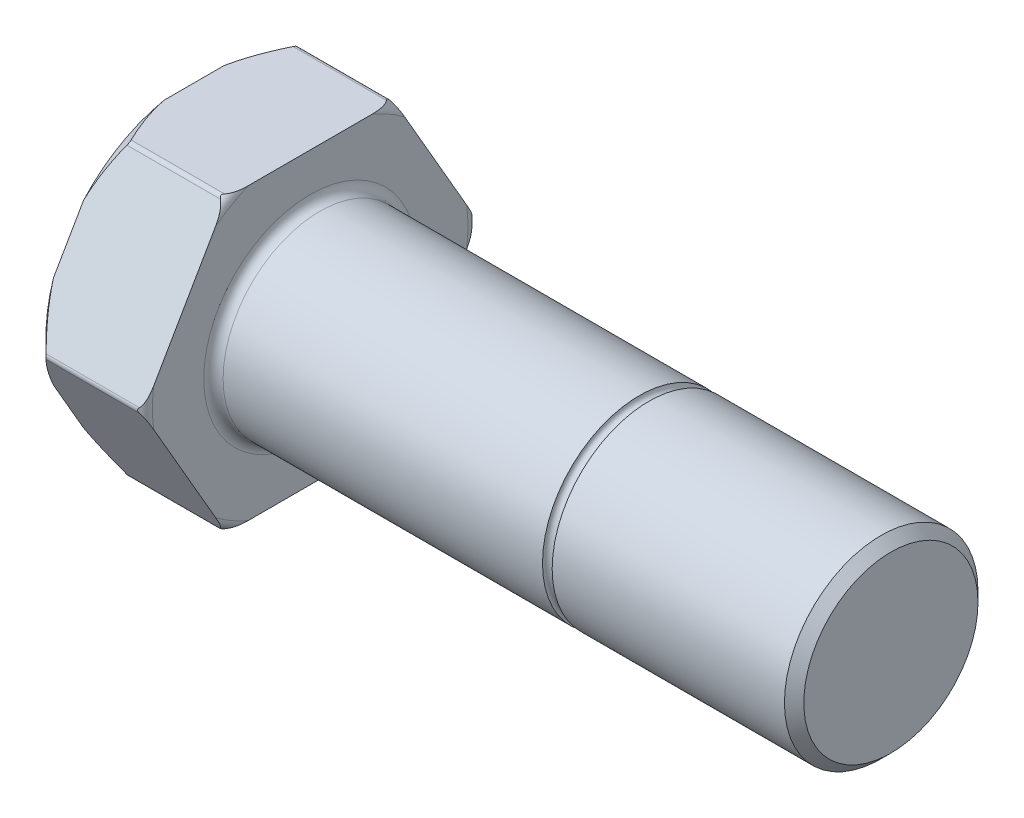
from build123d import *

# Parameters (mm, degrees)
REDONDEO1_R           = 1
CHAFL_N1_SIZE         = 1
CORTAR_EXTRUIR1_START = -12.000013
CROQUIS2_R            = 18.122324433
CORTAR_EXTRUIR1_DEPTH = 12.000014
REDONDEO3_R           = 0.5


with BuildPart() as part:
    # Croquis1 → Revolución1 (revolve)
    with BuildSketch(Plane.XY, mode=Mode.PRIVATE) as revoluci_n1_sk:
        with BuildLine():
            Line((0, 0), (0, 17.3))
            Line((0, 17.3), (12, 17.3))
            Line((12, 17.3), (12, 10))
            Line((12, 10), (46, 10))
            ThreePointArc((46, 10), (46.5, 9.5), (47, 10))
            Line((47, 10), (72, 10))
            Line((72, 10), (72, 0))
            Line((72, 0), (0, 0))
        make_face()
    revolve(revoluci_n1_sk.sketch.rotate(Axis((72, 0, 0), (-1, 0, 0)), 90), axis=Axis((72, 0, 0), (-1, 0, 0)))

    # Redondeo1
    redondeo1_edges = [part.edges().sort_by_distance(p)[0] for p in [
        (12, 0, 17.3),
        (12, 0, 10),
    ]]
    fillet(redondeo1_edges, radius=REDONDEO1_R)

    # Chaflán1
    chafl_n1_edges = [part.edges().sort_by_distance(p)[0] for p in [
        (72, 0, 10),
    ]]
    chamfer(chafl_n1_edges, length=CHAFL_N1_SIZE)

    # Croquis4 → Cortar-Revolución1 (revolve, cut)
    with BuildSketch(Plane.XY, mode=Mode.PRIVATE) as cortar_revoluci_n1_sk:
        Polygon((0, 17.3), (0, 15.3), (2, 17.3), align=None)
    revolve(cortar_revoluci_n1_sk.sketch.rotate(Axis((0, 0, 0), (1, 0, 0)), 270), axis=Axis((0, 0, 0), (1, 0, 0)), mode=Mode.SUBTRACT)

    # Croquis2 → Cortar-Extruir1 (cut)
    with BuildSketch(Plane.ZY.offset(CORTAR_EXTRUIR1_START)):
        Circle(CROQUIS2_R)
        Polygon((8.65, 14.982239485), (-8.65, 14.982239485), (-17.3, 0), (-8.65, -14.982239485), (8.65, -14.982239485), (17.3, 0), align=None, mode=Mode.SUBTRACT)
    extrude(amount=CORTAR_EXTRUIR1_DEPTH, mode=Mode.SUBTRACT)

    # Redondeo3
    redondeo3_edges = [part.edges().sort_by_distance(p)[0] for p in [
        (6.5, 14.982239485, 8.65),
        (6.5, 0, 17.3),
        (6.5, -14.982239485, 8.65),
        (6.5, 14.982239485, -8.65),
        (6.5, 0, -17.3),
        (6.5, -14.982239485, -8.65),
    ]]
    fillet(redondeo3_edges, radius=REDONDEO3_R)


solid = part.part
